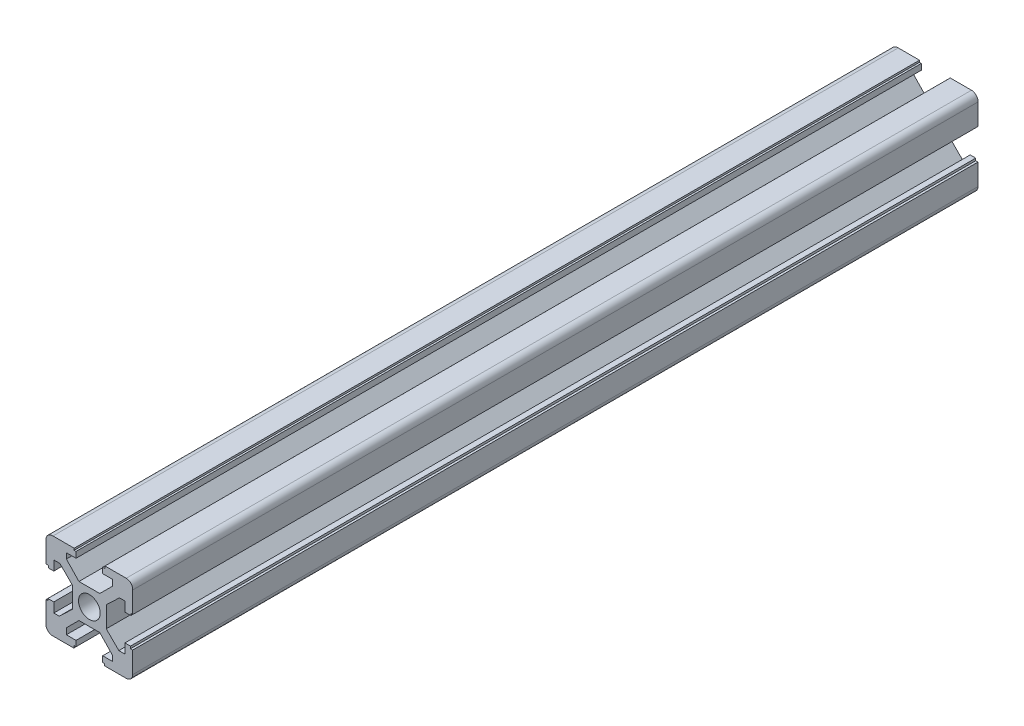
from build123d import *

# Parameters (mm, degrees)
SKETCH1_R           = 2.5
BOSS_EXTRUDE1_DEPTH = 195


with BuildPart() as part:
    # Sketch1 → Boss-Extrude1 (new body)
    with BuildSketch(Plane.XY):
        with BuildLine():
            Line((9.573137603, 3.497470387), (10, 3.497470387))
            Line((10, 3.497470387), (10, 8.397470387))
            ThreePointArc((10, 8.397470387), (9.598622578, 9.525052949), (8.5, 10))
            Line((8.5, 10), (3.6, 10))
            Line((3.6, 10), (3.6, 9.479132912))
            Line((3.6, 9.479132912), (3.075, 9.479132912))
            Line((3.075, 9.479132912), (3.075, 8.2))
            Line((3.075, 8.2), (5.304654122, 8.2))
            Line((5.304654122, 8.2), (5.304654122, 6.8))
            Line((5.304654122, 6.8), (2.404654122, 3.9))
            Line((2.404654122, 3.9), (-2.404654122, 3.9))
            Line((-2.404654122, 3.9), (-5.304654122, 6.94037733))
            Line((-5.304654122, 6.94037733), (-5.304654122, 8.2))
            Line((-5.304654122, 8.2), (-3.075, 8.2))
            Line((-3.075, 8.2), (-3.075, 9.565763355))
            Line((-3.075, 9.565763355), (-3.497470387, 9.573137603))
            Line((-3.497470387, 9.573137603), (-3.497470387, 10))
            Line((-3.497470387, 10), (-8.397470387, 10))
            ThreePointArc((-8.397470387, 10), (-9.525052949, 9.598622578), (-10, 8.5))
            Line((-10, 8.5), (-10, 3.6))
            Line((-10, 3.6), (-9.479132912, 3.6))
            Line((-9.479132912, 3.6), (-9.479132912, 3.075))
            Line((-9.479132912, 3.075), (-8.2, 3.075))
            Line((-8.2, 3.075), (-8.2, 5.304654122))
            Line((-8.2, 5.304654122), (-6.8, 5.304654122))
            Line((-6.8, 5.304654122), (-3.9, 2.404654122))
            Line((-3.9, 2.404654122), (-3.9, -2.404654122))
            Line((-3.9, -2.404654122), (-6.94037733, -5.304654122))
            Line((-6.94037733, -5.304654122), (-8.2, -5.304654122))
            Line((-8.2, -5.304654122), (-8.2, -3.075))
            Line((-8.2, -3.075), (-9.565763355, -3.075))
            Line((-9.565763355, -3.075), (-9.573137603, -3.497470387))
            Line((-9.573137603, -3.497470387), (-10, -3.497470387))
            Line((-10, -3.497470387), (-10, -8.397470387))
            ThreePointArc((-10, -8.397470387), (-9.598622578, -9.525052949), (-8.5, -10))
            Line((-8.5, -10), (-3.6, -10))
            Line((-3.6, -10), (-3.6, -9.479132912))
            Line((-3.6, -9.479132912), (-3.075, -9.479132912))
            Line((-3.075, -9.479132912), (-3.075, -8.2))
            Line((-3.075, -8.2), (-5.304654122, -8.2))
            Line((-5.304654122, -8.2), (-5.304654122, -6.8))
            Line((-5.304654122, -6.8), (-2.404654122, -3.9))
            Line((-2.404654122, -3.9), (2.404654122, -3.9))
            Line((2.404654122, -3.9), (5.304654122, -6.94037733))
            Line((5.304654122, -6.94037733), (5.304654122, -8.2))
            Line((5.304654122, -8.2), (3.075, -8.2))
            Line((3.075, -8.2), (3.075, -9.565763355))
            Line((3.075, -9.565763355), (3.497470387, -9.573137603))
            Line((3.497470387, -9.573137603), (3.497470387, -10))
            Line((3.497470387, -10), (8.397470387, -10))
            ThreePointArc((8.397470387, -10), (9.525052949, -9.598622578), (10, -8.5))
            Line((10, -8.5), (10, -3.6))
            Line((10, -3.6), (9.479132912, -3.6))
            Line((9.479132912, -3.6), (9.479132912, -3.075))
            Line((9.479132912, -3.075), (8.2, -3.075))
            Line((8.2, -3.075), (8.2, -5.304654122))
            Line((8.2, -5.304654122), (6.8, -5.304654122))
            Line((6.8, -5.304654122), (3.9, -2.404654122))
            Line((3.9, -2.404654122), (3.9, 2.404654122))
            Line((3.9, 2.404654122), (6.94037733, 5.304654122))
            Line((6.94037733, 5.304654122), (8.2, 5.304654122))
            Line((8.2, 5.304654122), (8.2, 3.075))
            Line((8.2, 3.075), (9.565763355, 3.075))
            Line((9.565763355, 3.075), (9.573137603, 3.497470387))
        make_face()
        Circle(SKETCH1_R, mode=Mode.SUBTRACT)
    extrude(amount=BOSS_EXTRUDE1_DEPTH)


solid = part.part
